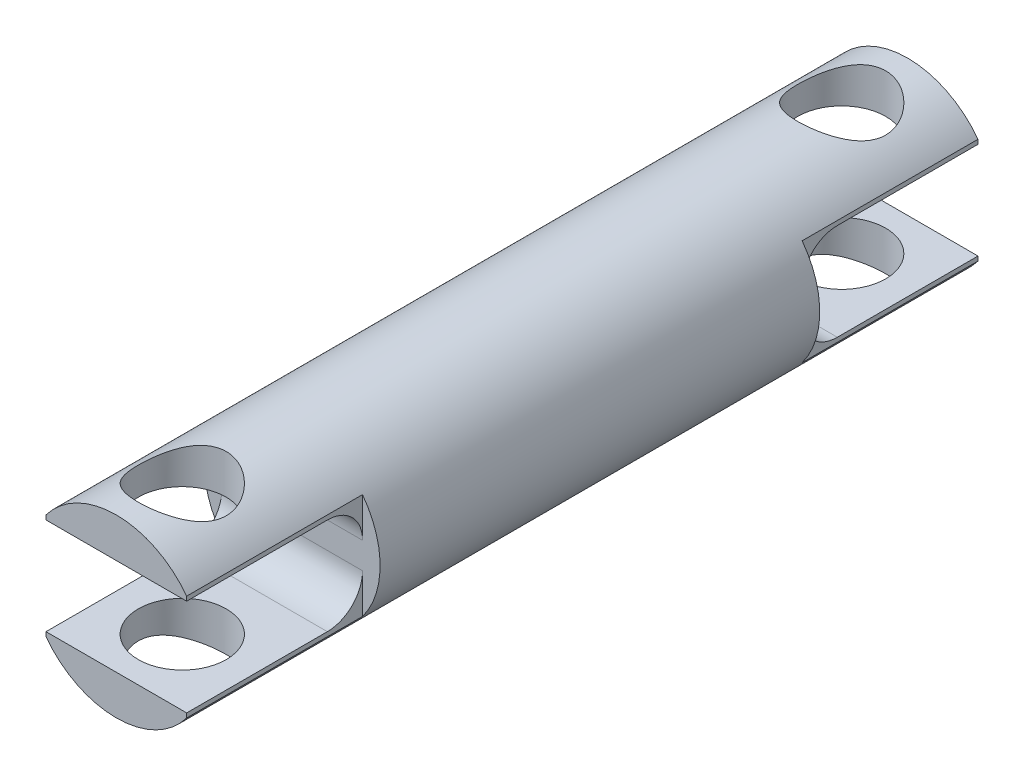
from build123d import *

# Parameters (mm, degrees)
SZKIC1_R                               = 20
DODANIE_WYCI_GNI_CIE1_DEPTH            = 50
DODANIE_WYCI_GNI_CIE4_DEPTH            = 40
SZKIC7_R                               = 10
WYTNIJ_WYCI_GNI_CIE1_DEPTH             = 40
WYTNIJ_WYCI_GNI_CIE1_DIRECTION_2_REACH = 99.268
ZAOKR_GLENIE1_R                        = 8
ZAOKR_GLENIE1_OF_LUSTRO2_R             = 8


with BuildPart() as part:
    # Szkic1 → Dodanie-wyciągnięcie1 (new body)
    with BuildSketch(Plane.XY):
        Circle(SZKIC1_R)
    dodanie_wyci_gni_cie1 = extrude(amount=DODANIE_WYCI_GNI_CIE1_DEPTH)

    # Szkic6 → Dodanie-wyciągnięcie4 (add)
    with BuildSketch(Plane.XY.offset(50)):
        with BuildLine():
            Line((-16, 12), (-16, 11))
            Line((-16, 11), (16, 11))
            Line((16, 11), (16, 12))
            ThreePointArc((16, 12), (0, 20), (-16, 12))
        make_face()
        with BuildLine():
            Line((16, -11), (16, -12))
            ThreePointArc((16, -12), (0, -20), (-16, -12))
            Line((-16, -12), (-16, -11))
            Line((-16, -11), (16, -11))
        make_face()
    dodanie_wyci_gni_cie4 = extrude(amount=DODANIE_WYCI_GNI_CIE4_DEPTH)

    # Szkic7 → Wytnij-wyciągnięcie1 (cut)
    with BuildSketch(Plane(origin=(0, -11, 0), x_dir=(1, 0, 0), z_dir=(0, 1, 0))):
        with Locations(Location((0, -75, 0), (0, 0, 270))):
            Circle(SZKIC7_R)
    wytnij_wyci_gni_cie1 = extrude(amount=WYTNIJ_WYCI_GNI_CIE1_DEPTH, mode=Mode.SUBTRACT)

    # Szkic7 → Wytnij-wyciągnięcie1 direction 2 (cut, up to next)
    with BuildSketch(Plane(origin=(0, -11, 0), x_dir=(1, 0, 0), z_dir=(0, 1, 0)), mode=Mode.PRIVATE) as wytnij_wyci_gni_cie1_direction_2_sk1:
        with Locations(Location((0, -75, 0), (0, 0, 270))):
            Circle(SZKIC7_R)
    wytnij_wyci_gni_cie1_direction_2_tool1 = extrude(wytnij_wyci_gni_cie1_direction_2_sk1.sketch, amount=-WYTNIJ_WYCI_GNI_CIE1_DIRECTION_2_REACH, mode=Mode.PRIVATE) & part.part
    wytnij_wyci_gni_cie1_direction_2 = wytnij_wyci_gni_cie1_direction_2_tool1.solids().sort_by_distance((0, -11, 75))[0]
    add(wytnij_wyci_gni_cie1_direction_2, mode=Mode.SUBTRACT)

    # Zaokrąglenie1
    zaokr_glenie1_edges = [part.edges().sort_by_distance(p)[0] for p in [
        (0, -11, 50),
        (0, 11, 50),
    ]]
    fillet(zaokr_glenie1_edges, radius=ZAOKR_GLENIE1_R)

    # Lustro2: Dodanie-wyciągnięcie1, Dodanie-wyciągnięcie4, Wytnij-wyciągnięcie1, Wytnij-wyciągnięcie1 direction 2 across plane
    add(dodanie_wyci_gni_cie1.mirror(Plane.XY))
    add(dodanie_wyci_gni_cie4.mirror(Plane.XY))
    add(wytnij_wyci_gni_cie1.mirror(Plane.XY), mode=Mode.SUBTRACT)
    add(wytnij_wyci_gni_cie1_direction_2.mirror(Plane.XY), mode=Mode.SUBTRACT)

    # Zaokrąglenie1 of Lustro2
    zaokr_glenie1_of_lustro2_edges = [part.edges().sort_by_distance(p)[0] for p in [
        (0, -11, -50),
        (0, 11, -50),
    ]]
    fillet(zaokr_glenie1_of_lustro2_edges, radius=ZAOKR_GLENIE1_OF_LUSTRO2_R)


solid = part.part
